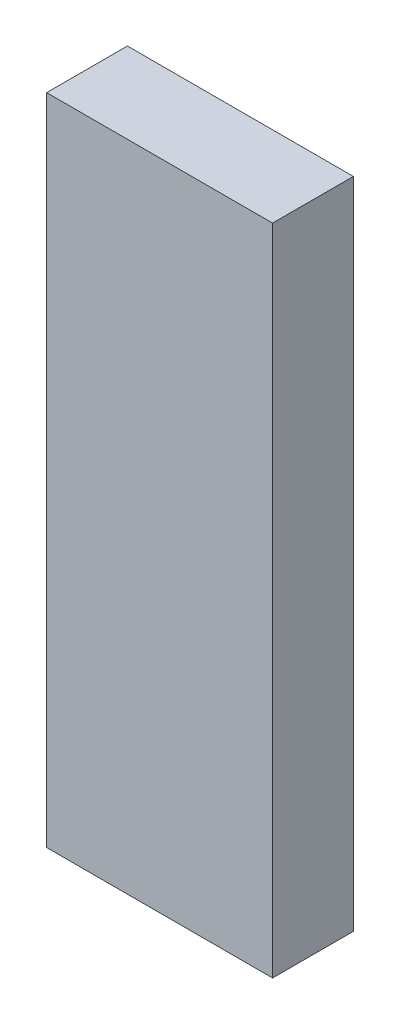
from build123d import *

# Parameters (mm, degrees)
SKETCH_1_W      = 895
SKETCH_1_H      = 2590
EXTRUDE_1_DEPTH = 320


with BuildPart() as part:
    # Эскиз1 → Бобышка-Вытянуть1 (new body)
    with BuildSketch(Plane.XY):
        Rectangle(SKETCH_1_W, SKETCH_1_H)
    extrude(amount=EXTRUDE_1_DEPTH)


solid = part.part
